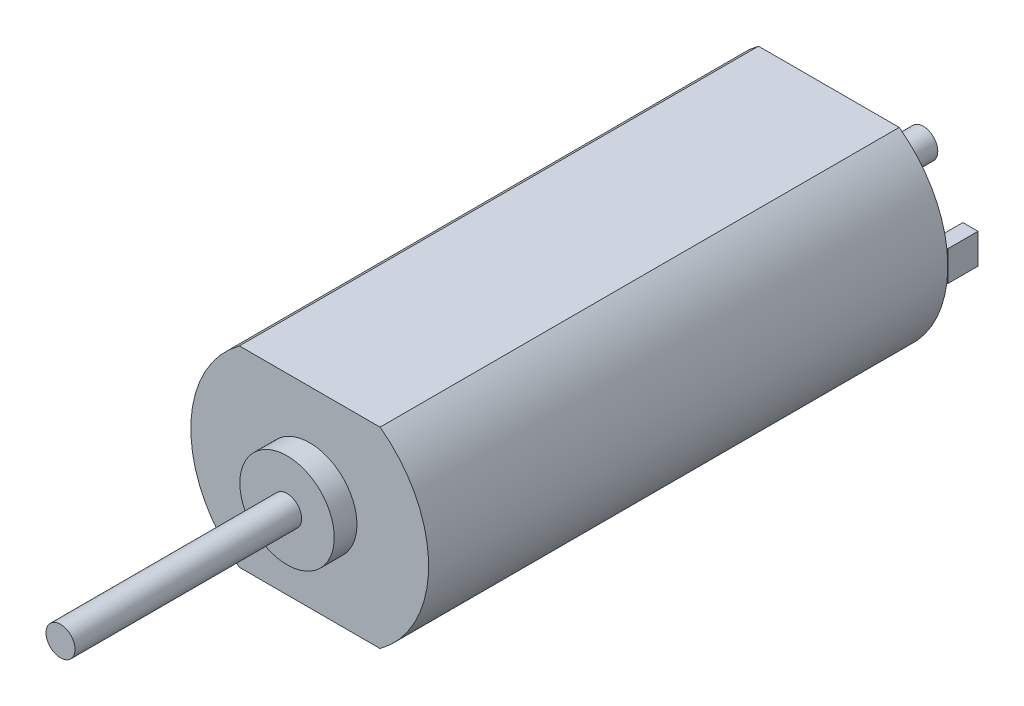
from build123d import *

# Parameters (mm, degrees)
BOSS_EXTRUDE1_DEPTH = 34.925
SKETCH2_R           = 3.175
BOSS_EXTRUDE2_DEPTH = 1.524
SKETCH3_R           = 0.9779
BOSS_EXTRUDE3_DEPTH = 15.24
BOSS_EXTRUDE4_START = 6.35
SKETCH4_R           = 0.9779
BOSS_EXTRUDE4_DEPTH = 6.35
SKETCH5_W           = 1.016
SKETCH5_H           = 2.032
BOSS_EXTRUDE5_DEPTH = 2.032


with BuildPart() as part:
    # Sketch1 → Boss-Extrude1 (new body)
    with BuildSketch(Plane.XY):
        with BuildLine():
            Line((4.732599708, 6.45), (-4.732599708, 6.45))
            ThreePointArc((-4.732599708, 6.45), (-8, 0), (-4.732599708, -6.45))
            Line((-4.732599708, -6.45), (4.732599708, -6.45))
            ThreePointArc((4.732599708, -6.45), (7.136553708, -3.615190336), (8, 0))
            ThreePointArc((8, 0), (7.136553708, 3.615190336), (4.732599708, 6.45))
        make_face()
    extrude(amount=BOSS_EXTRUDE1_DEPTH)

    # Sketch2 → Boss-Extrude2 (add)
    with BuildSketch(Plane.XY.offset(34.925)):
        with Locations(Location((0, 0, 0), (0, 0, 180))):
            Circle(SKETCH2_R)
    extrude(amount=BOSS_EXTRUDE2_DEPTH)

    # Sketch3 → Boss-Extrude3 (add)
    with BuildSketch(Plane.XY.offset(36.449)):
        with Locations(Location((0, 0, 0), (0, 0, 180))):
            Circle(SKETCH3_R)
    extrude(amount=BOSS_EXTRUDE3_DEPTH)

    # Sketch4 → Boss-Extrude4 (add)
    with BuildSketch(Plane(origin=(0, 0, 0), x_dir=(-1, 0, 0), z_dir=(0, 0, -1)).offset(BOSS_EXTRUDE4_START)):
        Circle(SKETCH4_R)
    extrude(amount=-BOSS_EXTRUDE4_DEPTH)

    # Sketch5 → Boss-Extrude5 (add)
    with BuildSketch(Plane(origin=(0, 0, 0), x_dir=(-1, 0, 0), z_dir=(0, 0, -1))):
        with Locations((-7.493, 0)):
            Rectangle(SKETCH5_W, SKETCH5_H)
        with Locations((7.493, 0)):
            Rectangle(SKETCH5_W, SKETCH5_H)
    extrude(amount=BOSS_EXTRUDE5_DEPTH)


solid = part.part
